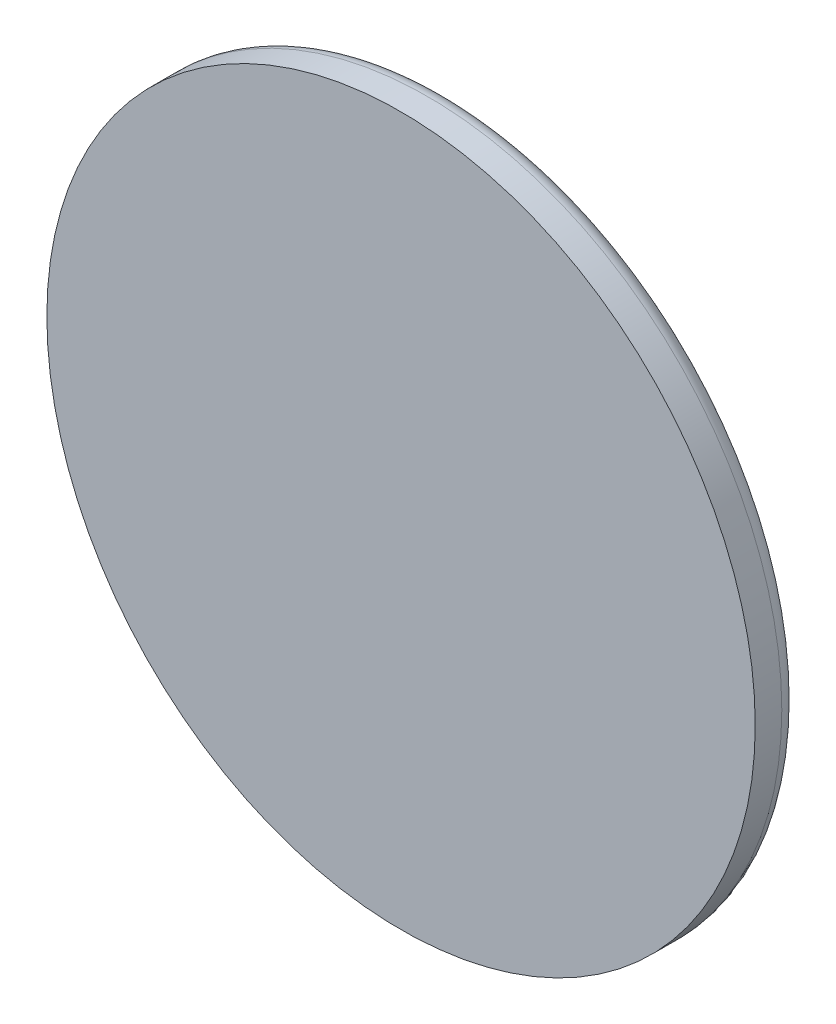
from build123d import *

# Parameters (mm, degrees)
SKETCH1_R           = 40
BOSS_EXTRUDE1_DEPTH = 5
FILLET2_R           = 2


with BuildPart() as part:
    # Sketch1 → Boss-Extrude1 (new body)
    with BuildSketch(Plane.XY):
        with Locations((-13.180023133, 8.447603815)):
            Circle(SKETCH1_R)
    extrude(amount=BOSS_EXTRUDE1_DEPTH)

    # Fillet2
    fillet2_edges = [part.edges().sort_by_distance(p)[0] for p in [
        (-53.180023133, 8.447603815, 0),
    ]]
    fillet(fillet2_edges, radius=FILLET2_R)


solid = part.part
